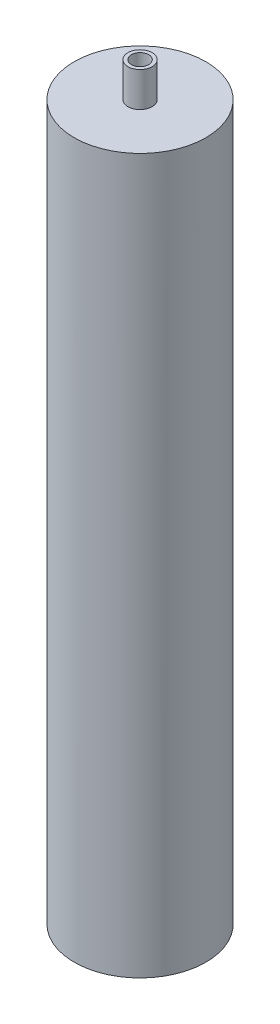
from build123d import *

# Parameters (mm, degrees)
SKETCH_1_R      = 19
SKETCH_1_R_2    = 18
EXTRUDE_1_DEPTH = 150
SKETCH_2_R      = 19
SKETCH_2_R_2    = 2
SKETCH_2_R_3    = 2.5
EXTRUDE_2_DEPTH = 2
SKETCH_3_R      = 19
SKETCH_3_R_2    = 18
EXTRUDE_3_DEPTH = 50
SKETCH_4_R      = 19
SKETCH_4_R_2    = 2.5
EXTRUDE_4_DEPTH = 2
SKETCH_5_R      = 3.5
SKETCH_5_R_2    = 2.5
EXTRUDE_5_DEPTH = 10
EXTRUDE_START   = 2
SKETCH_6_R      = 19
SKETCH_6_R_2    = 12.5
EXTRUDE_6_DEPTH = 2


with BuildPart() as part:
    # 草图1 → 凸台-拉伸1 (new body)
    with BuildSketch(Plane(origin=(0, 0, 0), x_dir=(1, 0, 0), z_dir=(0, 1, 0))):
        with Locations(Location((0, 0, 0), (0, 0, 270))):
            Circle(SKETCH_1_R)
        with Locations(Location((0, 0, 0), (0, 0, 270))):
            Circle(SKETCH_1_R_2, mode=Mode.SUBTRACT)
    extrude(amount=EXTRUDE_1_DEPTH)

    # 草图2 → 凸台-拉伸2 (add)
    with BuildSketch(Plane(origin=(0, 150, 0), x_dir=(1, 0, 0), z_dir=(0, 1, 0))):
        with Locations(Location((0, 0, 0), (0, 0, 270))):
            Circle(SKETCH_2_R)
        with Locations(Location((10, 0, 0), (0, 0, 270))):
            Circle(SKETCH_2_R_2, mode=Mode.SUBTRACT)
        with Locations(Location((-10, 0, 0), (0, 0, 270))):
            Circle(SKETCH_2_R_2, mode=Mode.SUBTRACT)
        with Locations(Location((0, -10, 0), (0, 0, 270))):
            Circle(SKETCH_2_R_2, mode=Mode.SUBTRACT)
        with Locations(Location((0, 0, 0), (0, 0, 270))):
            Circle(SKETCH_2_R_3, mode=Mode.SUBTRACT)
        Polygon((0, 10), (0, 15.61), (6.2, 15.61), (6.2, 9.89), (0, 9.89), align=None, mode=Mode.SUBTRACT)
    extrude(amount=EXTRUDE_2_DEPTH)

    # 草图3 → 凸台-拉伸3 (add)
    with BuildSketch(Plane(origin=(0, 152, 0), x_dir=(1, 0, 0), z_dir=(0, 1, 0))):
        with Locations(Location((0, 0, 0), (0, 0, 270))):
            Circle(SKETCH_3_R)
        with Locations(Location((0, 0, 0), (0, 0, 270))):
            Circle(SKETCH_3_R_2, mode=Mode.SUBTRACT)
    extrude(amount=EXTRUDE_3_DEPTH)

    # 草图4 → 凸台-拉伸4 (add)
    with BuildSketch(Plane(origin=(0, 202, 0), x_dir=(1, 0, 0), z_dir=(0, 1, 0))):
        with Locations(Location((0, 0, 0), (0, 0, 270))):
            Circle(SKETCH_4_R)
        with Locations(Location((0, 0, 0), (0, 0, 270))):
            Circle(SKETCH_4_R_2, mode=Mode.SUBTRACT)
    extrude(amount=EXTRUDE_4_DEPTH)

    # 草图5 → 凸台-拉伸5 (add)
    with BuildSketch(Plane(origin=(0, 204, 0), x_dir=(1, 0, 0), z_dir=(0, 1, 0))):
        with Locations(Location((0, 0, 0), (0, 0, 270))):
            Circle(SKETCH_5_R)
        with Locations(Location((0, 0, 0), (0, 0, 270))):
            Circle(SKETCH_5_R_2, mode=Mode.SUBTRACT)
    extrude(amount=EXTRUDE_5_DEPTH)

    # 草图6 → 凸台-拉伸6 (add)
    with BuildSketch(Plane.XZ.offset(EXTRUDE_START)):
        with Locations(Location((0, 0, 0), (0, 0, 270))):
            Circle(SKETCH_6_R)
        with Locations(Location((0, 0, 0), (0, 0, 270))):
            Circle(SKETCH_6_R_2, mode=Mode.SUBTRACT)
    extrude(amount=-EXTRUDE_6_DEPTH)


solid = part.part
